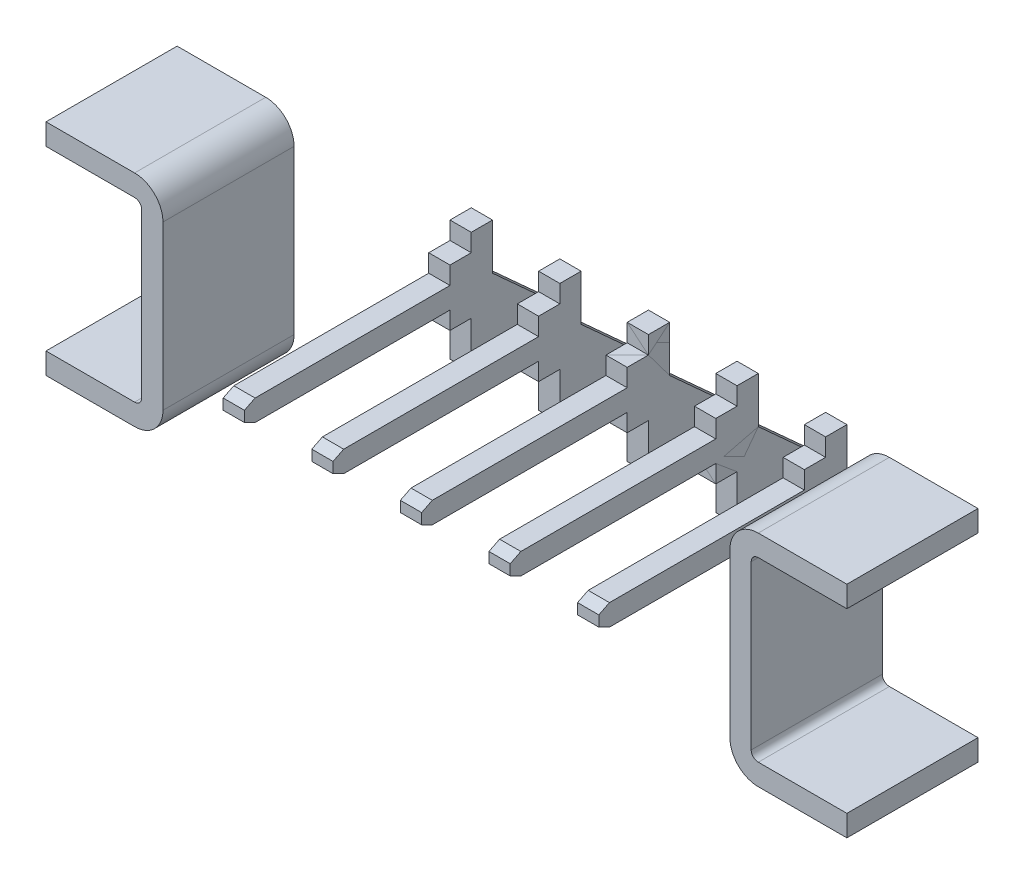
from build123d import *

# Parameters (mm, degrees)
BOSS_EXTRUDE1_DEPTH   = 0.15
LPATTERN1_COUNT       = 3
LPATTERN1_PITCH       = 1.25
LPATTERN1_2_COUNT     = 3
LPATTERN1_2_PITCH     = 1.25
EXTRUDE_THIN1_START   = -1.4
EXTRUDE_THIN1_DEPTH   = 1.85
EXTRUDE_THIN1_2_DEPTH = 1.85


with BuildPart() as part:
    # Sketch2 → Boss-Extrude1 (new, symmetric)
    with BuildSketch(Plane(origin=(0, 0, 0), x_dir=(0, 0, -1), z_dir=(1, 0, 0))):
        Polygon((3.8, 1.8), (3.8, 1.55), (1.05, 1.55), (0.9, 1.475), (0.9, 1.325), (1.05, 1.25), (3.8, 1.25), (3.8, 1), (4.1, 1), (4.1, 0.35), (4.55, 0.35), (4.55, 0), (5.5, 0), (5.5, 0.4), (4.4, 1.4), (4.4, 2.05), (4.1, 2.05), (4.1, 1.8), align=None)
    extrude(amount=BOSS_EXTRUDE1_DEPTH, both=True)


with BuildPart() as lpattern1_1:
    # LPattern1: pattern copy
    add(part.part.moved(Location(Vector(-1, 0, 0) * (1 * LPATTERN1_PITCH))))


with BuildPart() as lpattern1_2:
    # LPattern1: pattern copy
    add(part.part.moved(Location(Vector(-1, 0, 0) * (2 * LPATTERN1_PITCH))))


with BuildPart() as lpattern1_2_1:
    # LPattern1 2: pattern copy
    add(part.part.moved(Location(Vector(1, 0, 0) * (1 * LPATTERN1_2_PITCH))))


with BuildPart() as lpattern1_2_2:
    # LPattern1 2: pattern copy
    add(part.part.moved(Location(Vector(1, 0, 0) * (2 * LPATTERN1_2_PITCH))))


with BuildPart() as lpattern1_2_3:
    # LPattern1 2: pattern copy
    add(lpattern1_1.part.moved(Location(Vector(1, 0, 0) * (1 * LPATTERN1_2_PITCH))))


with BuildPart() as lpattern1_2_4:
    # LPattern1 2: pattern copy
    add(lpattern1_1.part.moved(Location(Vector(1, 0, 0) * (2 * LPATTERN1_2_PITCH))))


with BuildPart() as lpattern1_2_5:
    # LPattern1 2: pattern copy
    add(lpattern1_2.part.moved(Location(Vector(1, 0, 0) * (1 * LPATTERN1_2_PITCH))))


with BuildPart() as lpattern1_2_6:
    # LPattern1 2: pattern copy
    add(lpattern1_2.part.moved(Location(Vector(1, 0, 0) * (2 * LPATTERN1_2_PITCH))))


with BuildPart() as body_10:
    # Sketch3 → Extrude-Thin1 (new body)
    with BuildSketch(Plane.XY.offset(EXTRUDE_THIN1_START)):
        with BuildLine():
            Line((5.65, 3.1), (4.4, 3.1))
            ThreePointArc((4.4, 3.1), (4.117157288, 2.982842712), (4, 2.7))
            Line((4, 2.7), (4, 0.4))
            ThreePointArc((4, 0.4), (4.117157288, 0.117157288), (4.4, 0))
            Line((4.4, 0), (5.65, 0))
            Line((5.65, 0), (5.65, 0.3))
            Line((5.65, 0.3), (4.4, 0.3))
            ThreePointArc((4.4, 0.3), (4.329289322, 0.329289322), (4.3, 0.4))
            Line((4.3, 0.4), (4.3, 2.7))
            ThreePointArc((4.3, 2.7), (4.329289322, 2.770710678), (4.4, 2.8))
            Line((4.4, 2.8), (5.65, 2.8))
            Line((5.65, 2.8), (5.65, 3.1))
        make_face()
    extrude(amount=-EXTRUDE_THIN1_DEPTH)


with BuildPart() as body_11:
    # Sketch3 → Extrude-Thin1 2 (new body)
    with BuildSketch(Plane.XY.offset(EXTRUDE_THIN1_START)):
        with BuildLine():
            Line((-5.65, 2.8), (-4.4, 2.8))
            ThreePointArc((-4.4, 2.8), (-4.329289322, 2.770710678), (-4.3, 2.7))
            Line((-4.3, 2.7), (-4.3, 0.4))
            ThreePointArc((-4.3, 0.4), (-4.329289322, 0.329289322), (-4.4, 0.3))
            Line((-4.4, 0.3), (-5.65, 0.3))
            Line((-5.65, 0.3), (-5.65, 0))
            Line((-5.65, 0), (-4.4, 0))
            ThreePointArc((-4.4, 0), (-4.117157288, 0.117157288), (-4, 0.4))
            Line((-4, 0.4), (-4, 2.7))
            ThreePointArc((-4, 2.7), (-4.117157288, 2.982842712), (-4.4, 3.1))
            Line((-4.4, 3.1), (-5.65, 3.1))
            Line((-5.65, 3.1), (-5.65, 2.8))
        make_face()
    extrude(amount=-EXTRUDE_THIN1_2_DEPTH)


solid = Compound([part.part, lpattern1_1.part, lpattern1_2.part, lpattern1_2_1.part, lpattern1_2_2.part, lpattern1_2_3.part, lpattern1_2_4.part, lpattern1_2_5.part, lpattern1_2_6.part, body_10.part, body_11.part])
